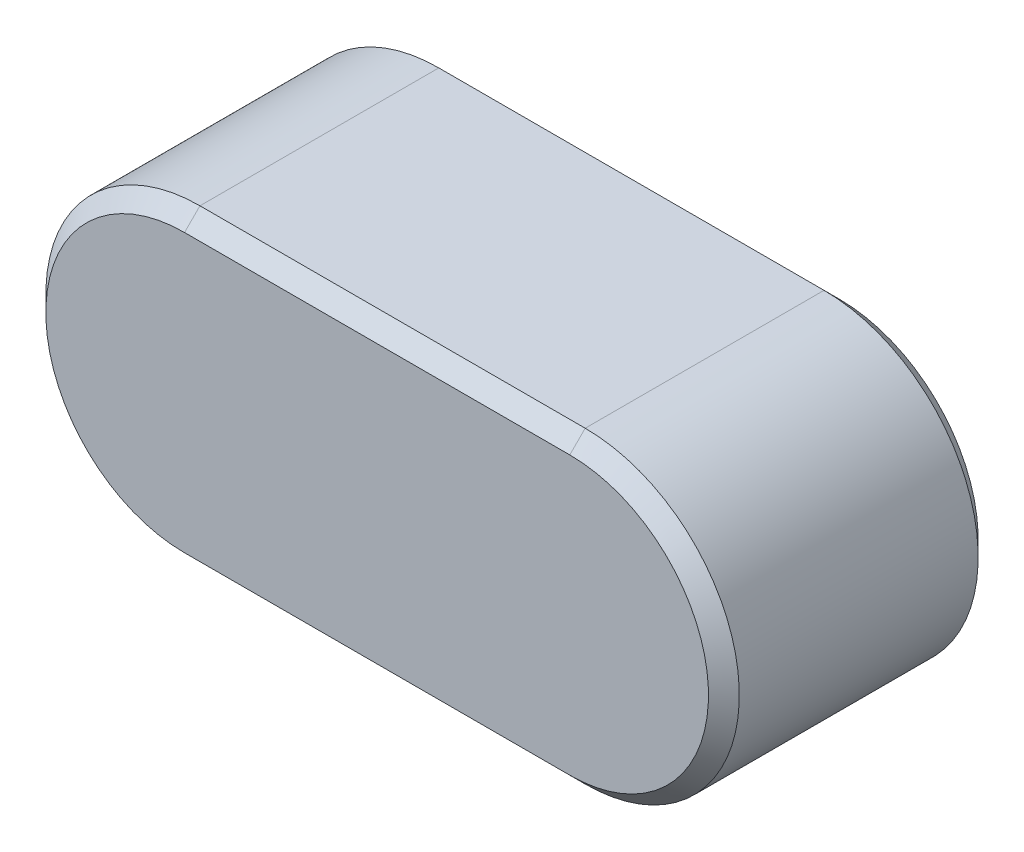
from build123d import *

# Parameters (mm, degrees)
BASEKEY_DEPTH = 3.5
CHAMFER1_SIZE = 0.4


with BuildPart() as part:
    # Sketch1 → BaseKey (new, symmetric)
    with BuildSketch(Plane.XY):
        with BuildLine():
            Line((-10, 4), (0, 4))
            ThreePointArc((0, 4), (4, 0), (0, -4))
            Line((0, -4), (-10, -4))
            ThreePointArc((-10, -4), (-14, 0), (-10, 4))
        make_face()
    extrude(amount=BASEKEY_DEPTH, both=True)

    # Chamfer1
    chamfer1_edges = [part.edges().sort_by_distance(p)[0] for p in [
        (4, 0, 3.5),
        (-5, 4, 3.5),
        (-14, 0, 3.5),
        (-5, 4, -3.5),
        (4, 0, -3.5),
        (-5, -4, -3.5),
        (-14, 0, -3.5),
        (-5, -4, 3.5),
    ]]
    chamfer(chamfer1_edges, length=CHAMFER1_SIZE)


solid = part.part
